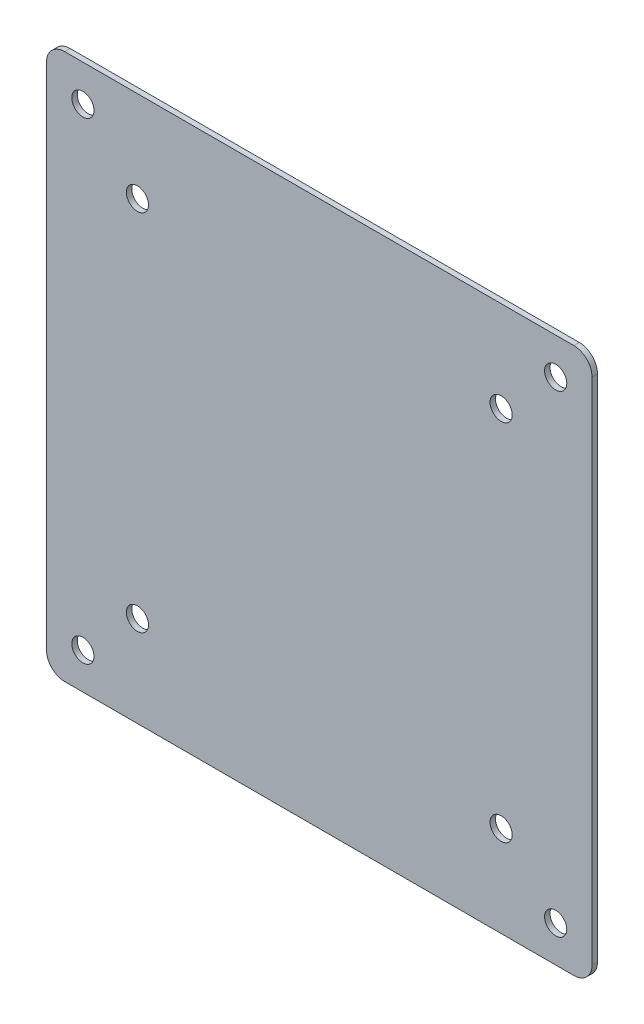
from build123d import *

# Parameters (mm, degrees)
SKETCH1_W                        = 300
SKETCH1_H                        = 300
BOSS_EXTRUDE1_DEPTH              = 3
F_12_2_12_2_DIAMETER_HOLE1_D     = 12.2
F_12_2_12_2_DIAMETER_HOLE1_DEPTH = 23
F_12_2_12_2_DIAMETER_HOLE1_TIP   = 3.665249776
FILLET1_R                        = 10


with BuildPart() as part:
    # Sketch1 → Boss-Extrude1 (new body)
    with BuildSketch(Plane.XY):
        Rectangle(SKETCH1_W, SKETCH1_H)
    extrude(amount=BOSS_EXTRUDE1_DEPTH)

    # Ø12.2 (12.2) Diameter Hole1
    with Locations(Plane.XY.offset(3)):
        with Locations((-130, -130), (-100, -100), (130, -130), (100, -100), (130, 130), (-100, 100), (-130, 130), (100, 100)):
            Hole(F_12_2_12_2_DIAMETER_HOLE1_D / 2, depth=F_12_2_12_2_DIAMETER_HOLE1_DEPTH)
            with Locations((0, 0, -(F_12_2_12_2_DIAMETER_HOLE1_DEPTH + F_12_2_12_2_DIAMETER_HOLE1_TIP / 2))):  # 118° drill point
                Cone(0, F_12_2_12_2_DIAMETER_HOLE1_D / 2, F_12_2_12_2_DIAMETER_HOLE1_TIP, mode=Mode.SUBTRACT)

    # Fillet1
    fillet1_edges = [part.edges().sort_by_distance(p)[0] for p in [
        (150, -150, 1.5),
        (-150, -150, 1.5),
        (-150, 150, 1.5),
        (150, 150, 1.5),
    ]]
    fillet(fillet1_edges, radius=FILLET1_R)


solid = part.part
